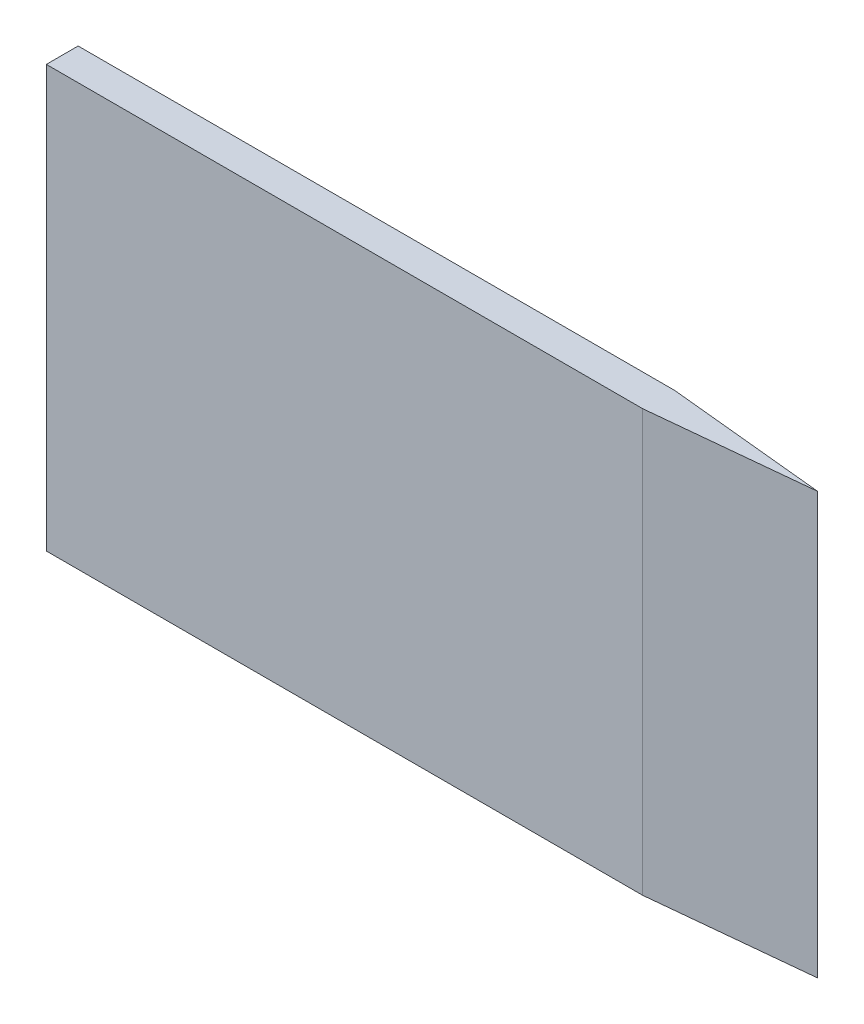
from build123d import *

# Parameters (mm, degrees)
SKETCH_1_W               = 95
SKETCH_1_H               = 53
EXTRUDE_1_DEPTH          = 2
CUT_EXTRUDE_1_DEPTH      = 55.428852643
CUT_EXTRUDE_1_DEPTH_BACK = 55.428852643


with BuildPart() as part:
    # 草图1 → 凸台-拉伸1 (new, symmetric)
    with BuildSketch(Plane.XY):
        Rectangle(SKETCH_1_W, SKETCH_1_H)
    extrude(amount=EXTRUDE_1_DEPTH, both=True)

    # 草图2 → 切除-拉伸1 (cut, two sides: drawn at the far end of the back side and taken through both)
    with BuildSketch(Plane(origin=(0, 0, 0), x_dir=(1, 0, 0), z_dir=(0, 1, 0)).offset(-CUT_EXTRUDE_1_DEPTH_BACK)):
        Polygon((-131.918074298, -17.94180743), (27.5, -2), (47.5, 0), (27.5, 2), (-131.918074298, 17.94180743), (188.508289392, 17.94180743), (188.508289392, -17.94180743), align=None)
    extrude(amount=CUT_EXTRUDE_1_DEPTH + CUT_EXTRUDE_1_DEPTH_BACK, mode=Mode.SUBTRACT)


solid = part.part
